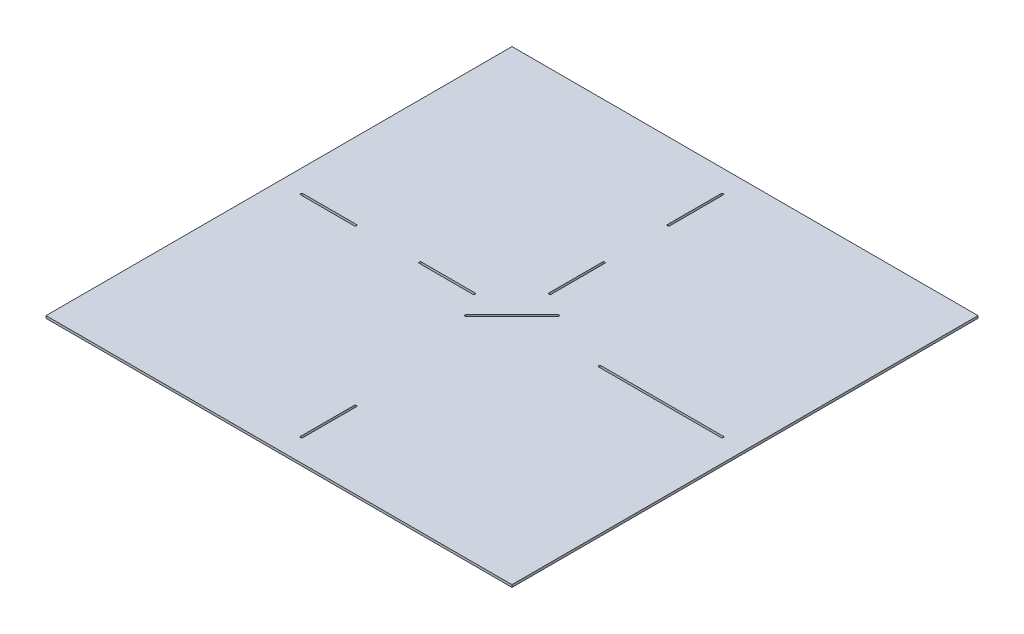
from build123d import *

# Parameters (mm, degrees)
SKETCH1_W           = 609.6
SKETCH1_H           = 609.6
BOSS_EXTRUDE1_DEPTH = 3.175
CUT_EXTRUDE2_DEPTH  = 432.063986695
CUT_EXTRUDE3_DEPTH  = 432.063986695


with BuildPart() as part:
    # Sketch1 → Boss-Extrude1 (new body)
    with BuildSketch(Plane(origin=(0, 0, 0), x_dir=(1, 0, 0), z_dir=(0, 1, 0))):
        Rectangle(SKETCH1_W, SKETCH1_H)
    extrude(amount=BOSS_EXTRUDE1_DEPTH)

    # Sketch3 → Cut-Extrude2 (cut, through all)
    with BuildSketch(Plane(origin=(0, 3.175, 0), x_dir=(1, 0, 0), z_dir=(0, 1, 0))):
        with BuildLine():
            Line((-31.060660172, -28.939339828), (28.939339828, 31.060660172))
            ThreePointArc((28.939339828, 31.060660172), (31.060660172, 31.060660172), (31.060660172, 28.939339828))
            Line((31.060660172, 28.939339828), (-28.939339828, -31.060660172))
            ThreePointArc((-28.939339828, -31.060660172), (-31.060660172, -31.060660172), (-31.060660172, -28.939339828))
        make_face()
    extrude(amount=-CUT_EXTRUDE2_DEPTH, mode=Mode.SUBTRACT)

    # Sketch4 → Cut-Extrude3 (cut, through all)
    with BuildSketch(Plane(origin=(0, 3.175, 0), x_dir=(1, 0, 0), z_dir=(0, 1, 0))):
        with BuildLine():
            Line((-50, -1.5), (-120, -1.5))
            ThreePointArc((-120, -1.5), (-121.5, 0), (-120, 1.5))
            Line((-120, 1.5), (-50, 1.5))
            ThreePointArc((-50, 1.5), (-48.5, 0), (-50, -1.5))
        make_face()
        with BuildLine():
            Line((-1.5, 50), (-1.5, 120))
            ThreePointArc((-1.5, 120), (0, 121.5), (1.5, 120))
            Line((1.5, 120), (1.5, 50))
            ThreePointArc((1.5, 50), (0, 48.5), (-1.5, 50))
        make_face()
        with BuildLine():
            Line((-1.5, -275), (-1.5, -205))
            ThreePointArc((-1.5, -205), (0, -203.5), (1.5, -205))
            Line((1.5, -205), (1.5, -275))
            ThreePointArc((1.5, -275), (0, -276.5), (-1.5, -275))
        make_face()
        with BuildLine():
            Line((275, -1.5), (115, -1.5))
            ThreePointArc((115, -1.5), (113.5, 0), (115, 1.5))
            Line((115, 1.5), (275, 1.5))
            ThreePointArc((275, 1.5), (276.5, 0), (275, -1.5))
        make_face()
        with BuildLine():
            Line((-275, 1.5), (-205, 1.5))
            ThreePointArc((-205, 1.5), (-203.5, 0), (-205, -1.5))
            Line((-205, -1.5), (-275, -1.5))
            ThreePointArc((-275, -1.5), (-276.5, 0), (-275, 1.5))
        make_face()
        with BuildLine():
            Line((1.5, 275), (1.5, 205))
            ThreePointArc((1.5, 205), (0, 203.5), (-1.5, 205))
            Line((-1.5, 205), (-1.5, 275))
            ThreePointArc((-1.5, 275), (0, 276.5), (1.5, 275))
        make_face()
    extrude(amount=-CUT_EXTRUDE3_DEPTH, mode=Mode.SUBTRACT)


solid = part.part
